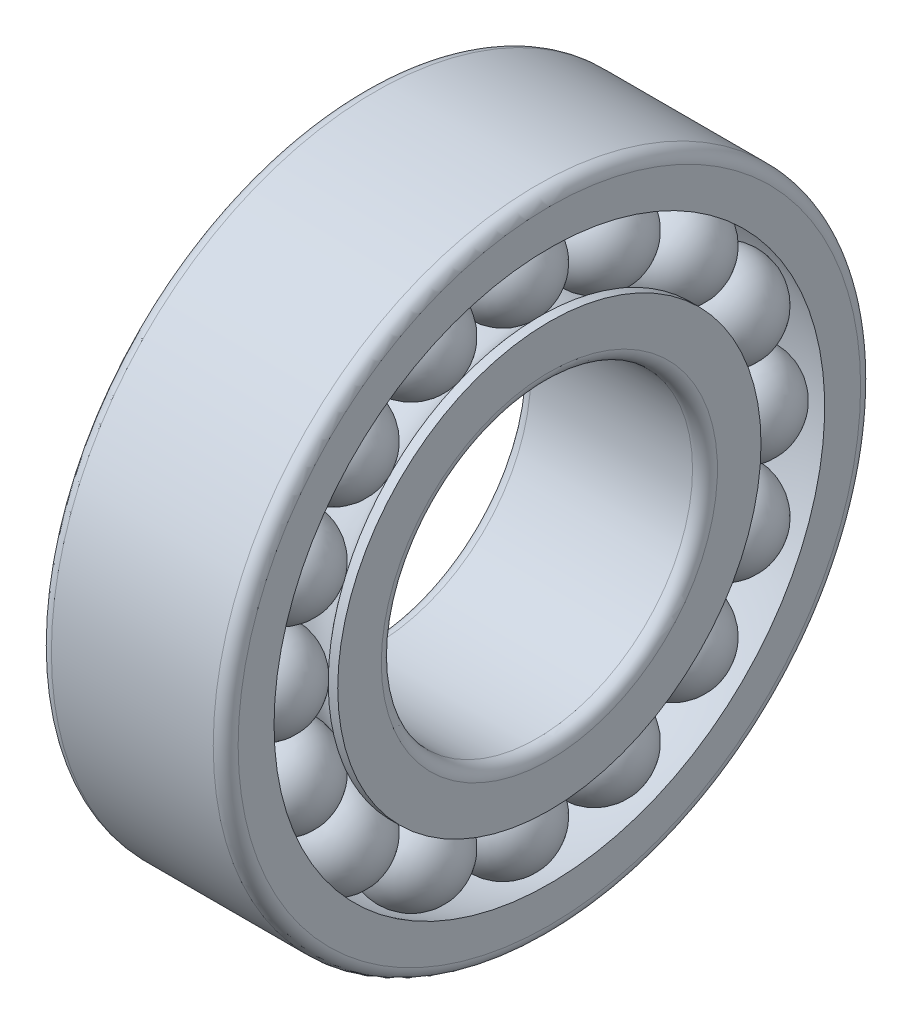
from build123d import *

# Parameters (mm, degrees)
CIRCULAR_PATTERN1_COUNT = 16
FILLET1_R               = 1


with BuildPart() as part:
    # Sketch1 → Revovle1 (revolve)
    with BuildSketch(Plane.XY, mode=Mode.PRIVATE) as revovle1_sk:
        with BuildLine():
            Line((-7.5, 12.5), (7.5, 12.5))
            Line((7.5, 12.5), (7.5, 17))
            Line((7.5, 17), (6.737490586, 17))
            ThreePointArc((6.737490586, 17), (3.75, 15.51), (0.762509414, 17))
            Line((0.762509414, 17), (-0.762509414, 17))
            ThreePointArc((-0.762509414, 17), (-3.75, 15.51), (-6.737490586, 17))
            Line((-6.737490586, 17), (-7.5, 17))
            Line((-7.5, 17), (-7.5, 12.5))
        make_face()
    revolve(revovle1_sk.sketch.rotate(Axis((0, 0, 0), (1, 0, 0)), 90), axis=Axis((0, 0, 0), (1, 0, 0)))

    # Sketch2 → Revolve2 (revolve)
    with BuildSketch(Plane.XY):
        with BuildLine():
            Line((-7.4995, 19.25), (-0.0005, 19.25))
            ThreePointArc((-0.0005, 19.25), (-3.75, 15.5005), (-7.4995, 19.25))
        make_face()
    revolve2 = revolve(axis=Axis((-4.033551893, 19.25, 0), (1, 0, 0)))

    # Mirror1: Revolve2 across plane
    add(revolve2.mirror(Plane(origin=(0, 0, 0), x_dir=(0, 0, 1), z_dir=(1, 0, 0))))

    # Sketch3 → Revolve3 (revolve)
    with BuildSketch(Plane.XY, mode=Mode.PRIVATE) as revolve3_sk:
        with BuildLine():
            Line((-7.5, 22.114685229), (-7.5, 26))
            Line((-7.5, 26), (7.5, 26))
            Line((7.5, 26), (7.5, 22.114685229))
            ThreePointArc((7.5, 22.114685229), (0, 23.351858657), (-7.5, 22.114685229))
        make_face()
    revolve(revolve3_sk.sketch.rotate(Axis((0, 0, 0), (1, 0, 0)), 90), axis=Axis((0, 0, 0), (1, 0, 0)))

    # Circular-Pattern1: Revolve2 ×16 about axis
    circular_pattern1_axis = Axis((0, 0, 0), (1, 0, 0))
    for i in range(1, CIRCULAR_PATTERN1_COUNT):
        add(revolve2.rotate(circular_pattern1_axis, i * 360 / CIRCULAR_PATTERN1_COUNT))

    # Circular-Pattern1 copy 1 sketch → Circular-Pattern1 copy 1 (revolve)
    with BuildSketch(Plane(origin=(0, 0, 0), x_dir=(-1, 0, 0), z_dir=(0, -0.3826834323650898, 0.9238795325112867))):
        with BuildLine():
            Line((-7.4995, -19.25), (-0.0005, -19.25))
            ThreePointArc((-0.0005, -19.25), (-3.75, -15.5005), (-7.4995, -19.25))
        make_face()
    revolve(axis=Axis((4.033551893, 17.784681001, 7.366656073), (1, 0, 0)))

    # Circular-Pattern1 copy 2 sketch → Circular-Pattern1 copy 2 (revolve)
    with BuildSketch(Plane(origin=(0, 0, 0), x_dir=(-1, 0, 0), z_dir=(0, -0.7071067811865475, 0.7071067811865476))):
        with BuildLine():
            Line((-7.4995, -19.25), (-0.0005, -19.25))
            ThreePointArc((-0.0005, -19.25), (-3.75, -15.5005), (-7.4995, -19.25))
        make_face()
    revolve(axis=Axis((4.033551893, 13.611805538, 13.611805538), (1, 0, 0)))

    # Circular-Pattern1 copy 3 sketch → Circular-Pattern1 copy 3 (revolve)
    with BuildSketch(Plane(origin=(0, 0, 0), x_dir=(-1, 0, 0), z_dir=(0, -0.9238795325112867, 0.38268343236508984))):
        with BuildLine():
            Line((-7.4995, -19.25), (-0.0005, -19.25))
            ThreePointArc((-0.0005, -19.25), (-3.75, -15.5005), (-7.4995, -19.25))
        make_face()
    revolve(axis=Axis((4.033551893, 7.366656073, 17.784681001), (1, 0, 0)))

    # Circular-Pattern1 copy 4 sketch → Circular-Pattern1 copy 4 (revolve)
    with BuildSketch(Plane(origin=(0, 0, 0), x_dir=(-1, 0, 0), z_dir=(0, -1, 0))):
        with BuildLine():
            Line((-7.4995, -19.25), (-0.0005, -19.25))
            ThreePointArc((-0.0005, -19.25), (-3.75, -15.5005), (-7.4995, -19.25))
        make_face()
    revolve(axis=Axis((4.033551893, 0, 19.25), (1, 0, 0)))

    # Circular-Pattern1 copy 5 sketch → Circular-Pattern1 copy 5 (revolve)
    with BuildSketch(Plane(origin=(0, 0, 0), x_dir=(-1, 0, 0), z_dir=(0, -0.9238795325112867, -0.3826834323650897))):
        with BuildLine():
            Line((-7.4995, -19.25), (-0.0005, -19.25))
            ThreePointArc((-0.0005, -19.25), (-3.75, -15.5005), (-7.4995, -19.25))
        make_face()
    revolve(axis=Axis((4.033551893, -7.366656073, 17.784681001), (1, 0, 0)))

    # Circular-Pattern1 copy 6 sketch → Circular-Pattern1 copy 6 (revolve)
    with BuildSketch(Plane(origin=(0, 0, 0), x_dir=(-1, 0, 0), z_dir=(0, -0.7071067811865476, -0.7071067811865475))):
        with BuildLine():
            Line((-7.4995, -19.25), (-0.0005, -19.25))
            ThreePointArc((-0.0005, -19.25), (-3.75, -15.5005), (-7.4995, -19.25))
        make_face()
    revolve(axis=Axis((4.033551893, -13.611805538, 13.611805538), (1, 0, 0)))

    # Circular-Pattern1 copy 7 sketch → Circular-Pattern1 copy 7 (revolve)
    with BuildSketch(Plane(origin=(0, 0, 0), x_dir=(-1, 0, 0), z_dir=(0, -0.3826834323650899, -0.9238795325112867))):
        with BuildLine():
            Line((-7.4995, -19.25), (-0.0005, -19.25))
            ThreePointArc((-0.0005, -19.25), (-3.75, -15.5005), (-7.4995, -19.25))
        make_face()
    revolve(axis=Axis((4.033551893, -17.784681001, 7.366656073), (1, 0, 0)))

    # Circular-Pattern1 copy 8 sketch → Circular-Pattern1 copy 8 (revolve)
    with BuildSketch(Plane(origin=(0, 0, 0), x_dir=(-1, 0, 0), z_dir=(0, 0, -1))):
        with BuildLine():
            Line((-7.4995, -19.25), (-0.0005, -19.25))
            ThreePointArc((-0.0005, -19.25), (-3.75, -15.5005), (-7.4995, -19.25))
        make_face()
    revolve(axis=Axis((4.033551893, -19.25, 0), (1, 0, 0)))

    # Circular-Pattern1 copy 9 sketch → Circular-Pattern1 copy 9 (revolve)
    with BuildSketch(Plane(origin=(0, 0, 0), x_dir=(-1, 0, 0), z_dir=(0, 0.38268343236508967, -0.9238795325112868))):
        with BuildLine():
            Line((-7.4995, -19.25), (-0.0005, -19.25))
            ThreePointArc((-0.0005, -19.25), (-3.75, -15.5005), (-7.4995, -19.25))
        make_face()
    revolve(axis=Axis((4.033551893, -17.784681001, -7.366656073), (1, 0, 0)))

    # Circular-Pattern1 copy 10 sketch → Circular-Pattern1 copy 10 (revolve)
    with BuildSketch(Plane(origin=(0, 0, 0), x_dir=(-1, 0, 0), z_dir=(0, 0.7071067811865475, -0.7071067811865477))):
        with BuildLine():
            Line((-7.4995, -19.25), (-0.0005, -19.25))
            ThreePointArc((-0.0005, -19.25), (-3.75, -15.5005), (-7.4995, -19.25))
        make_face()
    revolve(axis=Axis((4.033551893, -13.611805538, -13.611805538), (1, 0, 0)))

    # Circular-Pattern1 copy 11 sketch → Circular-Pattern1 copy 11 (revolve)
    with BuildSketch(Plane(origin=(0, 0, 0), x_dir=(-1, 0, 0), z_dir=(0, 0.9238795325112868, -0.3826834323650895))):
        with BuildLine():
            Line((-7.4995, -19.25), (-0.0005, -19.25))
            ThreePointArc((-0.0005, -19.25), (-3.75, -15.5005), (-7.4995, -19.25))
        make_face()
    revolve(axis=Axis((4.033551893, -7.366656073, -17.784681001), (1, 0, 0)))

    # Circular-Pattern1 copy 12 sketch → Circular-Pattern1 copy 12 (revolve)
    with BuildSketch(Plane(origin=(0, 0, 0), x_dir=(-1, 0, 0), z_dir=(0, 1, 0))):
        with BuildLine():
            Line((-7.4995, -19.25), (-0.0005, -19.25))
            ThreePointArc((-0.0005, -19.25), (-3.75, -15.5005), (-7.4995, -19.25))
        make_face()
    revolve(axis=Axis((4.033551893, 0, -19.25), (1, 0, 0)))

    # Circular-Pattern1 copy 13 sketch → Circular-Pattern1 copy 13 (revolve)
    with BuildSketch(Plane(origin=(0, 0, 0), x_dir=(-1, 0, 0), z_dir=(0, 0.9238795325112866, 0.38268343236509))):
        with BuildLine():
            Line((-7.4995, -19.25), (-0.0005, -19.25))
            ThreePointArc((-0.0005, -19.25), (-3.75, -15.5005), (-7.4995, -19.25))
        make_face()
    revolve(axis=Axis((4.033551893, 7.366656073, -17.784681001), (1, 0, 0)))

    # Circular-Pattern1 copy 14 sketch → Circular-Pattern1 copy 14 (revolve)
    with BuildSketch(Plane(origin=(0, 0, 0), x_dir=(-1, 0, 0), z_dir=(0, 0.7071067811865477, 0.7071067811865474))):
        with BuildLine():
            Line((-7.4995, -19.25), (-0.0005, -19.25))
            ThreePointArc((-0.0005, -19.25), (-3.75, -15.5005), (-7.4995, -19.25))
        make_face()
    revolve(axis=Axis((4.033551893, 13.611805538, -13.611805538), (1, 0, 0)))

    # Circular-Pattern1 copy 15 sketch → Circular-Pattern1 copy 15 (revolve)
    with BuildSketch(Plane(origin=(0, 0, 0), x_dir=(-1, 0, 0), z_dir=(0, 0.38268343236508956, 0.9238795325112868))):
        with BuildLine():
            Line((-7.4995, -19.25), (-0.0005, -19.25))
            ThreePointArc((-0.0005, -19.25), (-3.75, -15.5005), (-7.4995, -19.25))
        make_face()
    revolve(axis=Axis((4.033551893, 17.784681001, -7.366656073), (1, 0, 0)))

    # Fillet1
    fillet1_edges = [part.edges().sort_by_distance(p)[0] for p in [
        (7.5, 0, -26),
        (-7.5, 0, -26),
        (7.5, 0, -12.5),
        (-7.5, 0, -12.5),
    ]]
    fillet(fillet1_edges, radius=FILLET1_R)


solid = part.part
